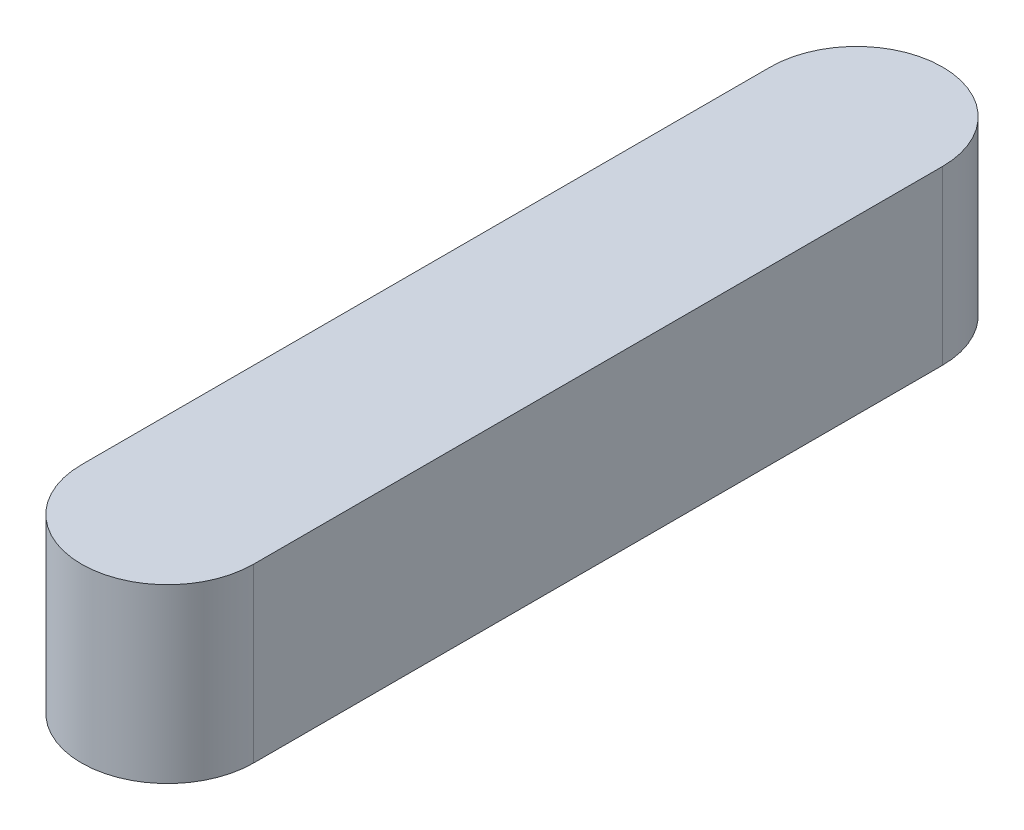
from build123d import *

# Parameters (mm, degrees)
BOSS_EXTRUDE1_START = 2
BOSS_EXTRUDE1_DEPTH = 4


with BuildPart() as part:
    # Sketch4 → Boss-Extrude1 (new body)
    with BuildSketch(Plane(origin=(0, 0, 0), x_dir=(1, 0, 0), z_dir=(0, 1, 0)).offset(BOSS_EXTRUDE1_START)):
        with BuildLine():
            Line((-2, -8), (-2, 8))
            ThreePointArc((-2, 8), (0, 10), (2, 8))
            Line((2, 8), (2, -8))
            ThreePointArc((2, -8), (0, -10), (-2, -8))
        make_face()
    extrude(amount=-BOSS_EXTRUDE1_DEPTH)


solid = part.part
